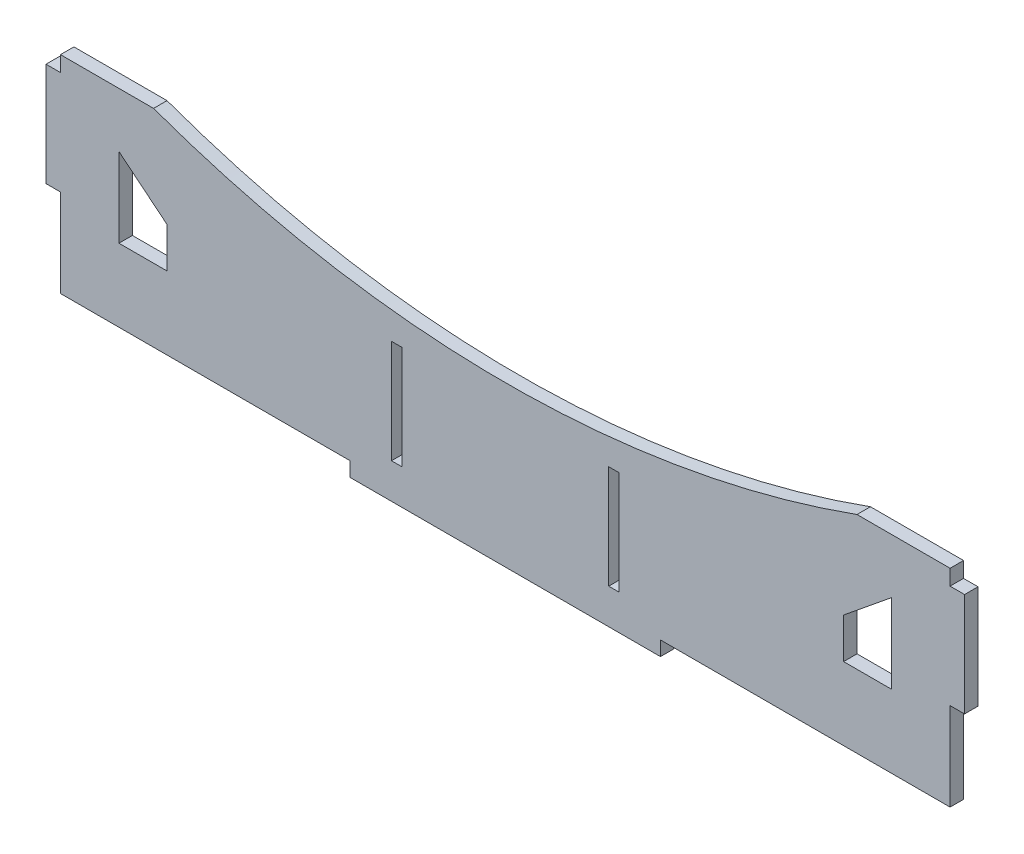
from build123d import *

# Parameters (mm, degrees)
SKETCH1_W           = 86
SKETCH1_H           = 20
BOSS_EXTRUDE1_DEPTH = 1.3
SKETCH2_W           = 30
SKETCH2_H           = 1.4
SKETCH2_W_2         = 1.4
SKETCH2_H_2         = 10
BOSS_EXTRUDE2_DEPTH = 1.3
CUT_EXTRUDE1_DEPTH  = 46.858586982
SKETCH4_W           = 1
SKETCH4_H           = 10
CUT_EXTRUDE2_DEPTH  = 46.858586982
CUT_EXTRUDE3_DEPTH  = 46.858586982


with BuildPart() as part:
    # Sketch1 → Boss-Extrude1 (new body)
    with BuildSketch(Plane.XY):
        Rectangle(SKETCH1_W, SKETCH1_H)
    extrude(amount=BOSS_EXTRUDE1_DEPTH)

    # Sketch2 → Boss-Extrude2 (add)
    with BuildSketch(Plane.XY.offset(1.3)):
        with Locations((0, -10.7)):
            Rectangle(SKETCH2_W, SKETCH2_H)
        with Locations((-43.7, 3.5)):
            Rectangle(SKETCH2_W_2, SKETCH2_H_2)
        with Locations((43.7, 3.5)):
            Rectangle(SKETCH2_W_2, SKETCH2_H_2)
    extrude(amount=-BOSS_EXTRUDE2_DEPTH)

    # Sketch3 → Cut-Extrude1 (cut, through all)
    with BuildSketch(Plane.XY.offset(1.3)):
        with BuildLine():
            Line((-34, 10), (34, 10))
            ThreePointArc((34, 10), (0, 4.033829384), (-34, 10))
        make_face()
    extrude(amount=-CUT_EXTRUDE1_DEPTH, mode=Mode.SUBTRACT)

    # Sketch4 → Cut-Extrude2 (cut, through all)
    with BuildSketch(Plane.XY.offset(1.3)):
        with Locations((-10.5, -3)):
            Rectangle(SKETCH4_W, SKETCH4_H)
        with Locations((10.5, -3)):
            Rectangle(SKETCH4_W, SKETCH4_H)
    extrude(amount=-CUT_EXTRUDE2_DEPTH, mode=Mode.SUBTRACT)

    # Sketch5 → Cut-Extrude3 (cut, through all)
    with BuildSketch(Plane.XY.offset(1.3)):
        Polygon((-37.347292806, 4.71481035), (-37.347292806, -2.961858542), (-32.708450107, -2.961858542), (-32.708450107, 0.938053462), align=None)
        Polygon((32.708450107, -2.961858542), (32.708450107, 0.938053462), (37.347292806, 4.71481035), (37.347292806, -2.961858542), align=None)
    extrude(amount=-CUT_EXTRUDE3_DEPTH, mode=Mode.SUBTRACT)


solid = part.part
